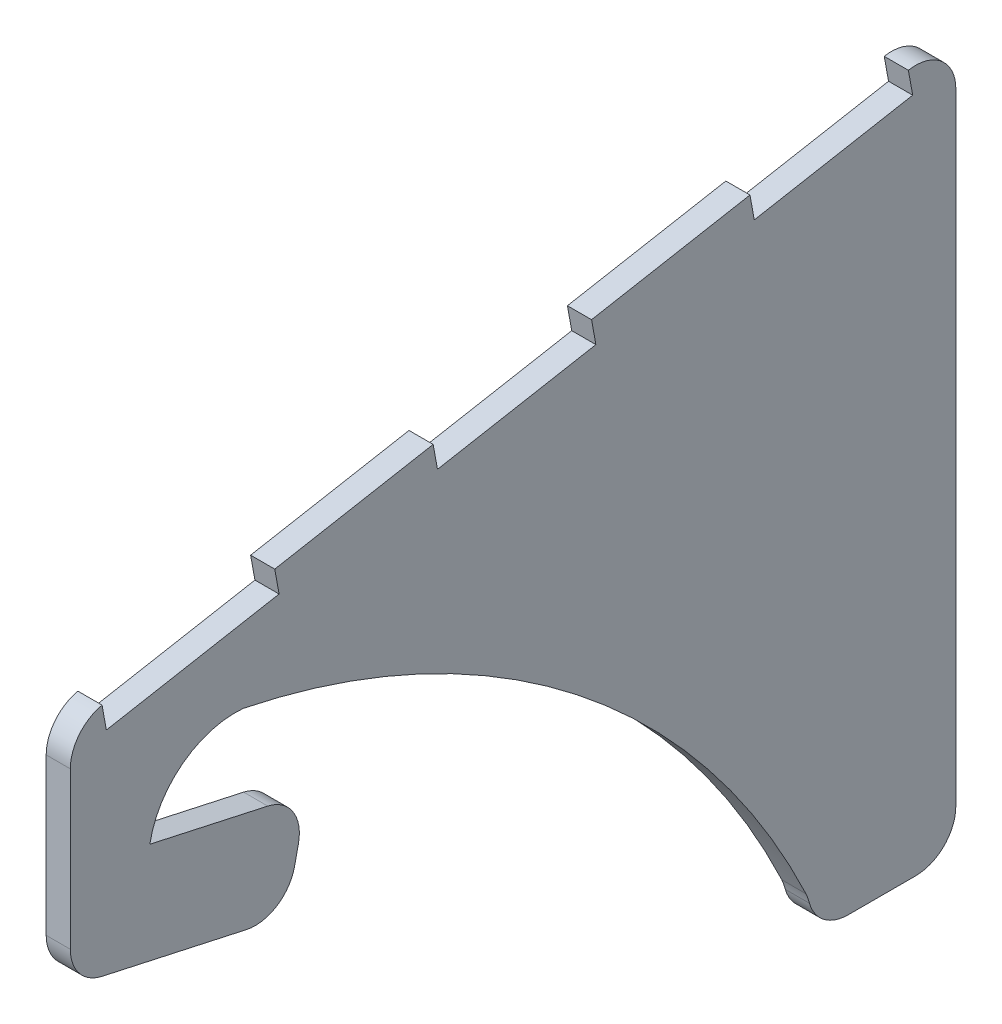
from build123d import *

# Parameters (mm, degrees)
SKETCH1_W           = 110
SKETCH1_H           = 110
BOSS_EXTRUDE1_DEPTH = 3
CUT_EXTRUDE1_DEPTH  = 10
CUT_EXTRUDE2_DEPTH  = 10
CUT_EXTRUDE3_DEPTH  = 10
FILLET1_R           = 5
SKETCH5_W           = 3
SKETCH5_H           = 20
SKETCH5_H_2         = 21.80661572
CUT_EXTRUDE4_DEPTH  = 3


with BuildPart() as part:
    # Sketch1 → Boss-Extrude1 (new body)
    with BuildSketch(Plane(origin=(0, 0, 0), x_dir=(0, 0, -1), z_dir=(1, 0, 0))):
        with Locations((55, -55)):
            Rectangle(SKETCH1_W, SKETCH1_H)
    extrude(amount=BOSS_EXTRUDE1_DEPTH)

    # Sketch2 → Cut-Extrude1 (cut)
    with BuildSketch(Plane(origin=(3, 0, 0), x_dir=(0, 0, -1), z_dir=(1, 0, 0))):
        with BuildLine():
            Line((26.778826095, -55.88152198), (29.40983865, -43.907010607))
            Line((29.40983865, -43.907010607), (9.875793007, -39.61503428))
            ThreePointArc((9.875793007, -39.61503428), (13.975453089, -32.950696648), (21.500097135, -30.80585613))
            ThreePointArc((21.500097135, -30.80585613), (62.897028718, -50.033250753), (91.384991868, -85.69604094))
            ThreePointArc((91.384991868, -85.69604094), (92.19972432, -90.586303718), (90.744288497, -95.325519429))
            Line((90.744288497, -95.325519429), (80.864556452, -107.820216293))
            Line((80.864556452, -107.820216293), (79.448988361, -110))
            Line((79.448988361, -110), (0, -110))
            Line((0, -110), (0, -69.727563309))
            Line((0, -69.727563309), (3.14357432, -66.357579934))
            ThreePointArc((3.14357432, -66.357579934), (4.130318316, -65.093257024), (4.613767896, -63.564057026))
            Line((4.613767896, -63.564057026), (24.14781354, -67.856033353))
            Line((24.14781354, -67.856033353), (26.778826095, -55.88152198))
        make_face()
    extrude(amount=-CUT_EXTRUDE1_DEPTH, mode=Mode.SUBTRACT)

    # Sketch3 → Cut-Extrude2 (cut)
    with BuildSketch(Plane(origin=(3, 0, 0), x_dir=(0, 0, -1), z_dir=(1, 0, 0))):
        Polygon((26.778826095, -55.88152198), (0, -49.997738878), (0, -22.392653141), (110, -2.392653141), (110, 0), (0, 0), (-15.446531008, -25.16825398), (-7.23919485, -70.308602848), (0, -69.727563309), (28.662258875, -73.688951531), (31.123409687, -55.88152198), align=None)
    extrude(amount=-CUT_EXTRUDE2_DEPTH, mode=Mode.SUBTRACT)

    # Sketch4 → Cut-Extrude3 (cut)
    with BuildSketch(Plane(origin=(3, 0, 0), x_dir=(0, 0, -1), z_dir=(1, 0, 0))):
        Polygon((92.19972432, -90.586303718), (110, -90.586303718), (115.849676558, -112.577173273), (92.19972432, -118.868173766), (68.110039343, -115.722673519), (77.620590823, -97.250185318), align=None)
    extrude(amount=-CUT_EXTRUDE3_DEPTH, mode=Mode.SUBTRACT)

    # Fillet1
    fillet1_edges = [part.edges().sort_by_distance(p)[0] for p in [
        (1.5, -90.586303718, -92.19972432),
        (1.5, -90.586303718, -110),
        (1.5, -43.907010607, -29.40983865),
        (1.5, -55.88152198, -26.778826095),
        (1.5, -2.392653141, -110),
        (1.5, -22.392653141, 0),
        (1.5, -49.997738878, 0),
    ]]
    fillet(fillet1_edges, radius=FILLET1_R)

    # Sketch5 → Cut-Extrude4 (cut)
    with BuildSketch(Plane(origin=(0, -21.676088241, -3.941106953), x_dir=(1, 0, 0), z_dir=(0, 0.9838699100999075, 0.17888543819998315))):
        with Locations((1.5, 91.80661572)):
            Rectangle(SKETCH5_W, SKETCH5_H)
        with Locations((1.5, 51.80661572)):
            Rectangle(SKETCH5_W, SKETCH5_H)
        with Locations((1.5, 10.90330786)):
            Rectangle(SKETCH5_W, SKETCH5_H_2)
    extrude(amount=-CUT_EXTRUDE4_DEPTH, mode=Mode.SUBTRACT)


solid = part.part
